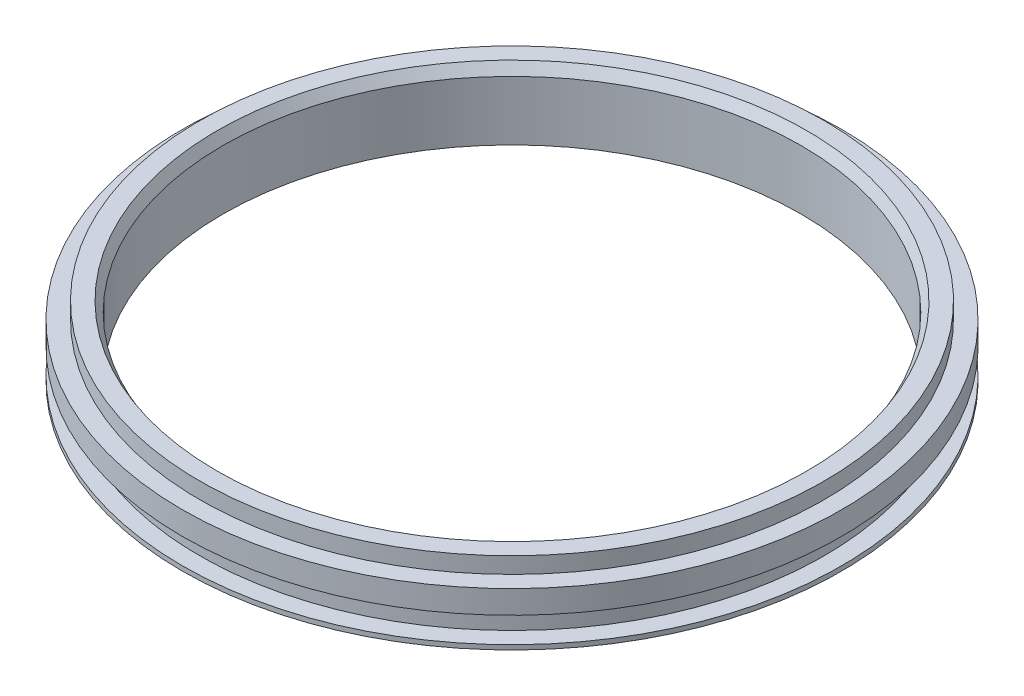
from build123d import *

# Parameters (mm, degrees)
CHAMFER1_SIZE  = 0.5
CHAMFER1_SIZE2 = 0.866025404


with BuildPart() as part:
    # Sketch2 → Revolve1 (revolve)
    with BuildSketch(Plane(origin=(0, 0, 0), x_dir=(0, 0, -1), z_dir=(1, 0, 0))):
        Polygon((27, 0), (27, 1.1), (28.5, 1.1), (28.5, 3.1), (27, 3.1), (27, 4.5), (25, 4.5), (25, -1.5), (28.5, -1.5), (28.5, -1.1), (27, -1.1), align=None)
    revolve(axis=Axis((0, 0, 0), (0, 1, 0)))

    # Chamfer1
    chamfer1_edges = [part.edges().sort_by_distance(p)[0] for p in [
        (0, 4.5, 25),
    ]]
    chamfer1_side = [part.faces().sort_by_distance(p)[0] for p in [
        (0, 4.5, 26.236324676),
    ]]
    chamfer(chamfer1_edges, length=CHAMFER1_SIZE, length2=CHAMFER1_SIZE2, reference=chamfer1_side[0])


solid = part.part
